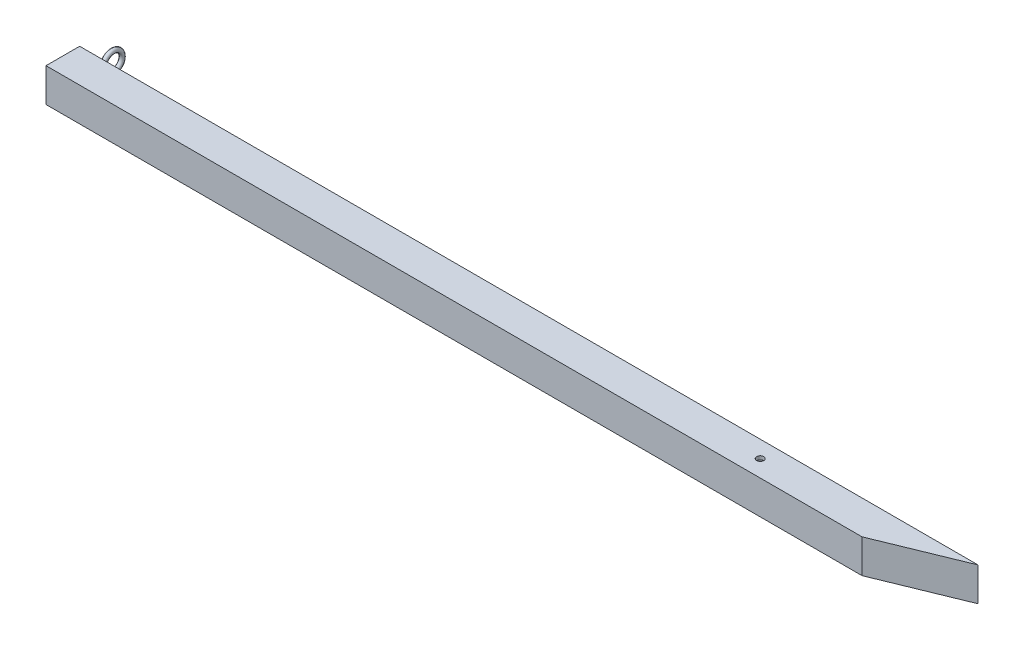
from build123d import *

# Parameters (mm, degrees)
SKETCH2_W           = 38
SKETCH2_H           = 38
SKETCH3_W           = 30
SKETCH3_H           = 30
SKETCH4_R           = 4
CUT_EXTRUDE1_DEPTH  = 1001.902093114
SWEEP2_PROFILE_R    = 2.5
CUT_EXTRUDE2_DEPTH  = 1003.203029253
BOSS_EXTRUDE1_DEPTH = 38
SKETCH22_W          = 30
SKETCH22_H          = 30
CUT_EXTRUDE3_DEPTH  = 1074.472400545
CUT_EXTRUDE4_DEPTH  = 1003.203029253
CUT_EXTRUDE5_DEPTH  = 1003.203029253
BOSS_EXTRUDE2_REACH = 1004.203


with BuildPart() as part:
    # Sweep1: sweep along a path in Sketch1
    with BuildLine(Plane(origin=(0, 0, 0), x_dir=(1, 0, 0), z_dir=(0, 1, 0))) as sweep1_path:
        Line((0, 0), (-1000, 0))
    # Sketch2 → Sweep1 (sweep)
    with BuildSketch(Plane(origin=(0, 0, 0), x_dir=(0, 0, -1), z_dir=(1, 0, 0))):
        Rectangle(SKETCH2_W, SKETCH2_H)
    sweep(path=sweep1_path.line)

    # Cut-Sweep1: sweep along a path in Sketch1<2>
    with BuildLine(Plane(origin=(0, 0, 0), x_dir=(1, 0, 0), z_dir=(0, 1, 0))) as cut_sweep1_path:
        Line((0, 0), (-1000, 0))
    # Sketch3 → Cut-Sweep1 (sweep, cut)
    with BuildSketch(Plane(origin=(0, 0, 0), x_dir=(0, 0, -1), z_dir=(1, 0, 0))):
        Rectangle(SKETCH3_W, SKETCH3_H)
    sweep(path=cut_sweep1_path.line, mode=Mode.SUBTRACT)

    # Sketch4 → Cut-Extrude1 (cut, through all)
    with BuildSketch(Plane(origin=(0, 19, 0), x_dir=(1, 0, 0), z_dir=(0, 1, 0))):
        with Locations((-212.63683242, 0)):
            Circle(SKETCH4_R)
    extrude(amount=-CUT_EXTRUDE1_DEPTH, mode=Mode.SUBTRACT)

    # Sweep2: sweep along a path in Sketch5
    with BuildLine(Plane.ZY.offset(985)) as sweep2_path:
        Line((-19, 0), (-26.570946825, 0))
        ThreePointArc((-26.570946825, 0), (-29.503401087, 0.950220747), (-31.321263798, 3.4397152))
        ThreePointArc((-31.321263798, 3.4397152), (-51.969366005, 0.135523131), (-31.321263798, -3.168668939))
    # Sweep2 profile (on start of the path) → Sweep2 (sweep)
    with BuildSketch(Plane(origin=(-985, 0, -19), x_dir=(0, -1, 0), z_dir=(0, 0, -1))):
        Circle(SWEEP2_PROFILE_R)
    sweep(path=sweep2_path.line)

    # Sketch16 → Cut-Extrude2 (cut, through all)
    with BuildSketch(Plane(origin=(0, 19, 0), x_dir=(1, 0, 0), z_dir=(0, 1, 0))):
        Polygon((0, -19), (0, 19), (-71.907398101, -19), align=None)
    extrude(amount=-CUT_EXTRUDE2_DEPTH, mode=Mode.SUBTRACT)

    # Sketch17 → Boss-Extrude1 (add)
    with BuildSketch(Plane(origin=(0, 19, 0), x_dir=(1, 0, 0), z_dir=(0, 1, 0))):
        Polygon((-71.907398101, -19), (0, -19), (71.921211139, 19), (0, 19), align=None)
    extrude(amount=-BOSS_EXTRUDE1_DEPTH)

    # Sketch22 → Cut-Extrude3 (cut, through all)
    with BuildSketch(Plane.ZY.offset(1000)):
        Rectangle(SKETCH22_W, SKETCH22_H)
    extrude(amount=-CUT_EXTRUDE3_DEPTH, mode=Mode.SUBTRACT)

    # Sketch23 → Cut-Extrude4 (cut, through all)
    with BuildSketch(Plane(origin=(0, 19, 0), x_dir=(1, 0, 0), z_dir=(0, 1, 0))):
        Polygon((14.258492684, 0), (-32.20683242, -19), (0, -19), (71.921211139, 19), (60.723817789, 19), align=None)
    extrude(amount=-CUT_EXTRUDE4_DEPTH, mode=Mode.SUBTRACT)

    # Sketch24 → Cut-Extrude5 (cut, through all)
    with BuildSketch(Plane(origin=(0, 19, 0), x_dir=(1, 0, 0), z_dir=(0, 1, 0))):
        Polygon((-78.672157524, -19), (14.258492684, 19), (60.723817789, 19), (-32.20683242, -19), align=None)
    extrude(amount=-CUT_EXTRUDE5_DEPTH, mode=Mode.SUBTRACT)

    # Sketch25 → Boss-Extrude2 (add, up to next)
    with BuildSketch(Plane(origin=(0, 19, 0), x_dir=(1, 0, 0), z_dir=(0, 1, 0)), mode=Mode.PRIVATE) as boss_extrude2_sk1:
        Polygon((3.690100071, 19), (-89.240550137, -19), (-78.672157524, -19), (14.258492684, 19), align=None)
    boss_extrude2_tool1 = extrude(boss_extrude2_sk1.sketch, amount=-BOSS_EXTRUDE2_REACH, mode=Mode.PRIVATE) - part.part
    add(boss_extrude2_tool1.solids().sort_by_distance((-37.491029, 19, 0))[0])


solid = part.part
